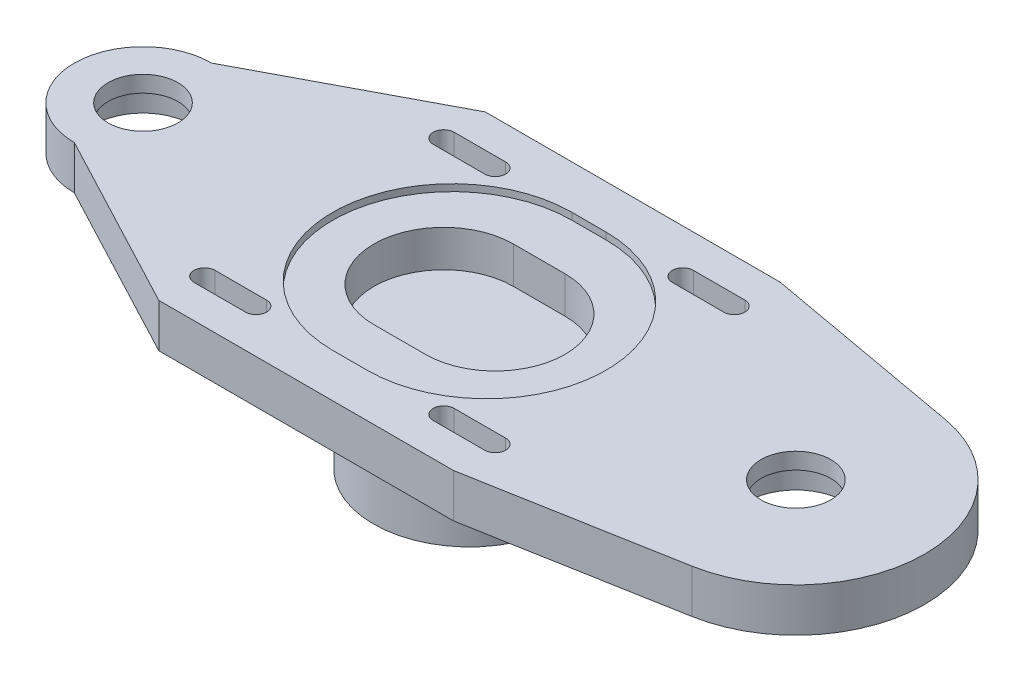
from build123d import *

# Parameters (mm, degrees)
SKETCH1_R               = 10.16
BOSS_EXTRUDE1_DEPTH     = 12.7
SKETCH2_R               = 14.2875
CUT_EXTRUDE1_DEPTH      = 7.9375
CUT_EXTRUDE2_DEPTH      = 5
CUT_EXTRUDE3_START      = 12.7
CUT_EXTRUDE3_DEPTH      = 2
CUT_EXTRUDE4_DEPTH      = 22
CUT_EXTRUDE4_DEPTH_BACK = 12
SKETCH6_R               = 27.94
BOSS_EXTRUDE2_DEPTH     = 32


with BuildPart() as part:
    # Sketch1 → Boss-Extrude1 (new body)
    with BuildSketch(Plane(origin=(0, 0, 0), x_dir=(1, 0, 0), z_dir=(0, 1, 0))):
        with BuildLine():
            Line((-42.9, 47.5), (42.9, 47.5))
            Line((42.9, 47.5), (101.65500633, 36.904754311))
            ThreePointArc((101.65500633, 36.904754311), (132.5, 0), (101.65500633, -36.904754311))
            Line((101.65500633, -36.904754311), (42.9, -47.5))
            Line((42.9, -47.5), (-42.9, -47.5))
            Line((-42.9, -47.5), (-95, -20))
            ThreePointArc((-95, -20), (-115, 0), (-95, 20))
            Line((-95, 20), (-42.9, 47.5))
        make_face()
        with Locations(Location((-95, 0, 0), (0, 0, 270))):
            Circle(SKETCH1_R, mode=Mode.SUBTRACT)
        with Locations(Location((95, 0, 0), (0, 0, 270))):
            Circle(SKETCH1_R, mode=Mode.SUBTRACT)
        with BuildLine():
            Line((-42.3, 37.85), (-27.3, 37.85))
            ThreePointArc((-27.3, 37.85), (-24.25, 34.8), (-27.3, 31.75))
            Line((-27.3, 31.75), (-42.3, 31.75))
            ThreePointArc((-42.3, 31.75), (-45.35, 34.8), (-42.3, 37.85))
        make_face(mode=Mode.SUBTRACT)
        with BuildLine():
            Line((42.3, 31.75), (27.3, 31.75))
            ThreePointArc((27.3, 31.75), (24.25, 34.8), (27.3, 37.85))
            Line((27.3, 37.85), (42.3, 37.85))
            ThreePointArc((42.3, 37.85), (45.35, 34.8), (42.3, 31.75))
        make_face(mode=Mode.SUBTRACT)
        with BuildLine():
            Line((42.3, -37.85), (27.3, -37.85))
            ThreePointArc((27.3, -37.85), (24.25, -34.8), (27.3, -31.75))
            Line((27.3, -31.75), (42.3, -31.75))
            ThreePointArc((42.3, -31.75), (45.35, -34.8), (42.3, -37.85))
        make_face(mode=Mode.SUBTRACT)
        with BuildLine():
            Line((-42.3, -31.75), (-27.3, -31.75))
            ThreePointArc((-27.3, -31.75), (-24.25, -34.8), (-27.3, -37.85))
            Line((-27.3, -37.85), (-42.3, -37.85))
            ThreePointArc((-42.3, -37.85), (-45.35, -34.8), (-42.3, -31.75))
        make_face(mode=Mode.SUBTRACT)
        with BuildLine():
            Line((-8, 7.5), (8, 7.5))
            ThreePointArc((8, 7.5), (15.5, 0), (8, -7.5))
            Line((8, -7.5), (-8, -7.5))
            ThreePointArc((-8, -7.5), (-15.5, 0), (-8, 7.5))
        make_face(mode=Mode.SUBTRACT)
    extrude(amount=BOSS_EXTRUDE1_DEPTH)

    # Sketch2 → Cut-Extrude1 (cut)
    with BuildSketch(Plane(origin=(0, 0, 0), x_dir=(1, 0, 0), z_dir=(0, 1, 0))):
        with Locations(Location((-95, 0, 0), (0, 0, 270))):
            Circle(SKETCH2_R)
        with Locations(Location((95, 0, 0), (0, 0, 270))):
            Circle(SKETCH2_R)
    extrude(amount=CUT_EXTRUDE1_DEPTH, mode=Mode.SUBTRACT)

    # Sketch3 → Cut-Extrude2 (cut)
    with BuildSketch(Plane(origin=(0, 0, 0), x_dir=(1, 0, 0), z_dir=(0, 1, 0))):
        with BuildLine():
            Line((-40.8, -40.05), (-28.8, -40.05))
            ThreePointArc((-28.8, -40.05), (-23.55, -34.8), (-28.8, -29.55))
            Line((-28.8, -29.55), (-40.8, -29.55))
            ThreePointArc((-40.8, -29.55), (-46.05, -34.8), (-40.8, -40.05))
        make_face()
        with BuildLine():
            Line((40.8, -29.55), (28.8, -29.55))
            ThreePointArc((28.8, -29.55), (23.55, -34.8), (28.8, -40.05))
            Line((28.8, -40.05), (40.8, -40.05))
            ThreePointArc((40.8, -40.05), (46.05, -34.8), (40.8, -29.55))
        make_face()
        with BuildLine():
            Line((40.8, 40.05), (28.8, 40.05))
            ThreePointArc((28.8, 40.05), (23.55, 34.8), (28.8, 29.55))
            Line((28.8, 29.55), (40.8, 29.55))
            ThreePointArc((40.8, 29.55), (46.05, 34.8), (40.8, 40.05))
        make_face()
        with BuildLine():
            ThreePointArc((-28.8, 29.55), (-23.55, 34.8), (-28.8, 40.05))
            Line((-28.8, 40.05), (-40.8, 40.05))
            ThreePointArc((-40.8, 40.05), (-46.05, 34.8), (-40.8, 29.55))
            Line((-40.8, 29.55), (-28.8, 29.55))
        make_face()
    extrude(amount=CUT_EXTRUDE2_DEPTH, mode=Mode.SUBTRACT)

    # Sketch4 → Cut-Extrude3 (cut)
    with BuildSketch(Plane(origin=(0, 0, 0), x_dir=(1, 0, 0), z_dir=(0, 1, 0)).offset(CUT_EXTRUDE3_START)):
        with BuildLine():
            Line((-5, 34.8), (5, 34.8))
            ThreePointArc((5, 34.8), (39.8, 0), (5, -34.8))
            Line((5, -34.8), (-5, -34.8))
            ThreePointArc((-5, -34.8), (-39.8, 0), (-5, 34.8))
        make_face()
    extrude(amount=-CUT_EXTRUDE3_DEPTH, mode=Mode.SUBTRACT)

    # Sketch5 → Cut-Extrude4 (cut, two sides: drawn at the far end of the back side and taken through both)
    with BuildSketch(Plane(origin=(0, 0, 0), x_dir=(1, 0, 0), z_dir=(0, 1, 0)).offset(-CUT_EXTRUDE4_DEPTH_BACK)):
        with BuildLine():
            Line((-7.5, 20.32), (7.5, 20.32))
            ThreePointArc((7.5, 20.32), (27.82, 0), (7.5, -20.32))
            Line((7.5, -20.32), (-7.5, -20.32))
            ThreePointArc((-7.5, -20.32), (-27.82, 0), (-7.5, 20.32))
        make_face()
    extrude(amount=CUT_EXTRUDE4_DEPTH + CUT_EXTRUDE4_DEPTH_BACK, mode=Mode.SUBTRACT)

    # Sketch6 → Boss-Extrude2 (add)
    with BuildSketch(Plane(origin=(0, 0, 0), x_dir=(1, 0, 0), z_dir=(0, 1, 0))):
        with Locations(Location((0, 0, 0), (0, 0, 270))):
            Circle(SKETCH6_R)
    extrude(amount=-BOSS_EXTRUDE2_DEPTH)


solid = part.part
